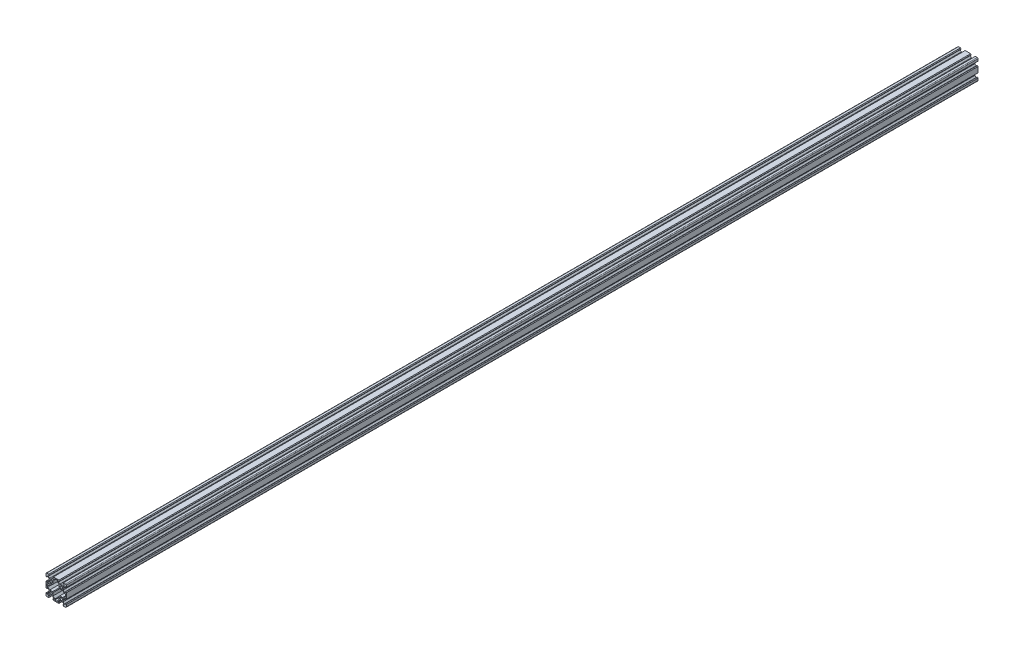
from build123d import *

# Parameters (mm, degrees)
SKETCH1_R           = 2.3
BOSS_EXTRUDE1_DEPTH = 1800


with BuildPart() as part:
    # Sketch1 → Boss-Extrude1 (new body)
    with BuildSketch(Plane.XY):
        with BuildLine():
            Line((14.58, -20), (18.5, -20))
            ThreePointArc((18.5, -20), (19.560660172, -19.560660172), (20, -18.5))
            Line((20, -18.5), (20, -14.58))
            Line((20, -14.58), (18.815, -13.395))
            Line((18.815, -13.395), (18.2, -13.395))
            Line((18.2, -13.395), (18.2, -15.5))
            Line((18.2, -15.5), (16.560660172, -15.5))
            Line((16.560660172, -15.5), (13.9, -12.839339828))
            Line((13.9, -12.839339828), (13.9, -10.21))
            Line((13.9, -10.21), (13.69, -10))
            Line((13.69, -10), (13.9, -9.79))
            Line((13.9, -9.79), (13.9, -7.160660172))
            Line((13.9, -7.160660172), (16.560660172, -4.5))
            Line((16.560660172, -4.5), (18.2, -4.5))
            Line((18.2, -4.5), (18.2, -6.605))
            Line((18.2, -6.605), (18.815, -6.605))
            Line((18.815, -6.605), (20, -5.42))
            Line((20, -5.42), (20, 5.42))
            Line((20, 5.42), (18.815, 6.605))
            Line((18.815, 6.605), (18.2, 6.605))
            Line((18.2, 6.605), (18.2, 4.5))
            Line((18.2, 4.5), (16.560660172, 4.5))
            Line((16.560660172, 4.5), (13.9, 7.160660172))
            Line((13.9, 7.160660172), (13.9, 9.79))
            Line((13.9, 9.79), (13.69, 10))
            Line((13.69, 10), (13.9, 10.21))
            Line((13.9, 10.21), (13.9, 12.839339828))
            Line((13.9, 12.839339828), (16.560660172, 15.5))
            Line((16.560660172, 15.5), (18.2, 15.5))
            Line((18.2, 15.5), (18.2, 13.395))
            Line((18.2, 13.395), (18.815, 13.395))
            Line((18.815, 13.395), (20, 14.58))
            Line((20, 14.58), (20, 18.5))
            ThreePointArc((20, 18.5), (19.560660172, 19.560660172), (18.5, 20))
            Line((18.5, 20), (14.58, 20))
            Line((14.58, 20), (13.395, 18.815))
            Line((13.395, 18.815), (13.395, 18.2))
            Line((13.395, 18.2), (15.5, 18.2))
            Line((15.5, 18.2), (15.5, 16.560660172))
            Line((15.5, 16.560660172), (12.839339828, 13.9))
            Line((12.839339828, 13.9), (10.21, 13.9))
            Line((10.21, 13.9), (10, 13.69))
            Line((10, 13.69), (9.79, 13.9))
            Line((9.79, 13.9), (7.160660172, 13.9))
            Line((7.160660172, 13.9), (4.5, 16.560660172))
            Line((4.5, 16.560660172), (4.5, 18.2))
            Line((4.5, 18.2), (6.605, 18.2))
            Line((6.605, 18.2), (6.605, 18.815))
            Line((6.605, 18.815), (5.42, 20))
            Line((5.42, 20), (-5.42, 20))
            Line((-5.42, 20), (-6.605, 18.815))
            Line((-6.605, 18.815), (-6.605, 18.2))
            Line((-6.605, 18.2), (-4.5, 18.2))
            Line((-4.5, 18.2), (-4.5, 16.560660172))
            Line((-4.5, 16.560660172), (-7.160660172, 13.9))
            Line((-7.160660172, 13.9), (-9.79, 13.9))
            Line((-9.79, 13.9), (-10, 13.69))
            Line((-10, 13.69), (-10.21, 13.9))
            Line((-10.21, 13.9), (-12.839339828, 13.9))
            Line((-12.839339828, 13.9), (-15.5, 16.560660172))
            Line((-15.5, 16.560660172), (-15.5, 18.2))
            Line((-15.5, 18.2), (-13.395, 18.2))
            Line((-13.395, 18.2), (-13.395, 18.815))
            Line((-13.395, 18.815), (-14.58, 20))
            Line((-14.58, 20), (-18.5, 20))
            ThreePointArc((-18.5, 20), (-19.560660172, 19.560660172), (-20, 18.5))
            Line((-20, 18.5), (-20, 14.58))
            Line((-20, 14.58), (-18.815, 13.395))
            Line((-18.815, 13.395), (-18.2, 13.395))
            Line((-18.2, 13.395), (-18.2, 15.5))
            Line((-18.2, 15.5), (-16.560660172, 15.5))
            Line((-16.560660172, 15.5), (-13.9, 12.839339828))
            Line((-13.9, 12.839339828), (-13.9, 10.21))
            Line((-13.9, 10.21), (-13.69, 10))
            Line((-13.69, 10), (-13.9, 9.79))
            Line((-13.9, 9.79), (-13.9, 7.160660172))
            Line((-13.9, 7.160660172), (-16.560660172, 4.5))
            Line((-16.560660172, 4.5), (-18.2, 4.5))
            Line((-18.2, 4.5), (-18.2, 6.605))
            Line((-18.2, 6.605), (-18.815, 6.605))
            Line((-18.815, 6.605), (-20, 5.42))
            Line((-20, 5.42), (-20, -5.42))
            Line((-20, -5.42), (-18.815, -6.605))
            Line((-18.815, -6.605), (-18.2, -6.605))
            Line((-18.2, -6.605), (-18.2, -4.5))
            Line((-18.2, -4.5), (-16.560660172, -4.5))
            Line((-16.560660172, -4.5), (-13.9, -7.160660172))
            Line((-13.9, -7.160660172), (-13.9, -9.79))
            Line((-13.9, -9.79), (-13.69, -10))
            Line((-13.69, -10), (-13.9, -10.21))
            Line((-13.9, -10.21), (-13.9, -12.839339828))
            Line((-13.9, -12.839339828), (-16.560660172, -15.5))
            Line((-16.560660172, -15.5), (-18.2, -15.5))
            Line((-18.2, -15.5), (-18.2, -13.395))
            Line((-18.2, -13.395), (-18.815, -13.395))
            Line((-18.815, -13.395), (-20, -14.58))
            Line((-20, -14.58), (-20, -18.5))
            ThreePointArc((-20, -18.5), (-19.560660172, -19.560660172), (-18.5, -20))
            Line((-18.5, -20), (-14.58, -20))
            Line((-14.58, -20), (-13.395, -18.815))
            Line((-13.395, -18.815), (-13.395, -18.2))
            Line((-13.395, -18.2), (-15.5, -18.2))
            Line((-15.5, -18.2), (-15.5, -16.560660172))
            Line((-15.5, -16.560660172), (-12.839339828, -13.9))
            Line((-12.839339828, -13.9), (-10.21, -13.9))
            Line((-10.21, -13.9), (-10, -13.69))
            Line((-10, -13.69), (-9.79, -13.9))
            Line((-9.79, -13.9), (-7.160660172, -13.9))
            Line((-7.160660172, -13.9), (-4.5, -16.560660172))
            Line((-4.5, -16.560660172), (-4.5, -18.2))
            Line((-4.5, -18.2), (-6.605, -18.2))
            Line((-6.605, -18.2), (-6.605, -18.815))
            Line((-6.605, -18.815), (-5.42, -20))
            Line((-5.42, -20), (5.42, -20))
            Line((5.42, -20), (6.605, -18.815))
            Line((6.605, -18.815), (6.605, -18.2))
            Line((6.605, -18.2), (4.5, -18.2))
            Line((4.5, -18.2), (4.5, -16.560660172))
            Line((4.5, -16.560660172), (7.160660172, -13.9))
            Line((7.160660172, -13.9), (9.79, -13.9))
            Line((9.79, -13.9), (10, -13.69))
            Line((10, -13.69), (10.21, -13.9))
            Line((10.21, -13.9), (12.839339828, -13.9))
            Line((12.839339828, -13.9), (15.5, -16.560660172))
            Line((15.5, -16.560660172), (15.5, -18.2))
            Line((15.5, -18.2), (13.395, -18.2))
            Line((13.395, -18.2), (13.395, -18.815))
            Line((13.395, -18.815), (14.58, -20))
        make_face()
        with Locations((-10, -10)):
            Circle(SKETCH1_R, mode=Mode.SUBTRACT)
        with Locations((10, -10)):
            Circle(SKETCH1_R, mode=Mode.SUBTRACT)
        Polygon((-16.239339828, -2.7), (-18.2, -2.7), (-18.2, 2.7), (-16.239339828, 2.7), (-12.839339828, 6.1), (-7.160660172, 6.1), (-6.1, 7.160660172), (-6.1, 12.839339828), (-2.7, 16.239339828), (-2.7, 18.2), (2.7, 18.2), (2.7, 16.239339828), (6.1, 12.839339828), (6.1, 7.160660172), (7.160660172, 6.1), (12.839339828, 6.1), (16.239339828, 2.7), (18.2, 2.7), (18.2, -2.7), (16.239339828, -2.7), (12.839339828, -6.1), (7.160660172, -6.1), (6.1, -7.160660172), (6.1, -12.839339828), (2.7, -16.239339828), (2.7, -18.2), (-2.7, -18.2), (-2.7, -16.239339828), (-6.1, -12.839339828), (-6.1, -7.160660172), (-7.160660172, -6.1), (-12.839339828, -6.1), align=None, mode=Mode.SUBTRACT)
        with Locations((-10, 10)):
            Circle(SKETCH1_R, mode=Mode.SUBTRACT)
        with Locations((10, 10)):
            Circle(SKETCH1_R, mode=Mode.SUBTRACT)
    extrude(amount=BOSS_EXTRUDE1_DEPTH)


solid = part.part
